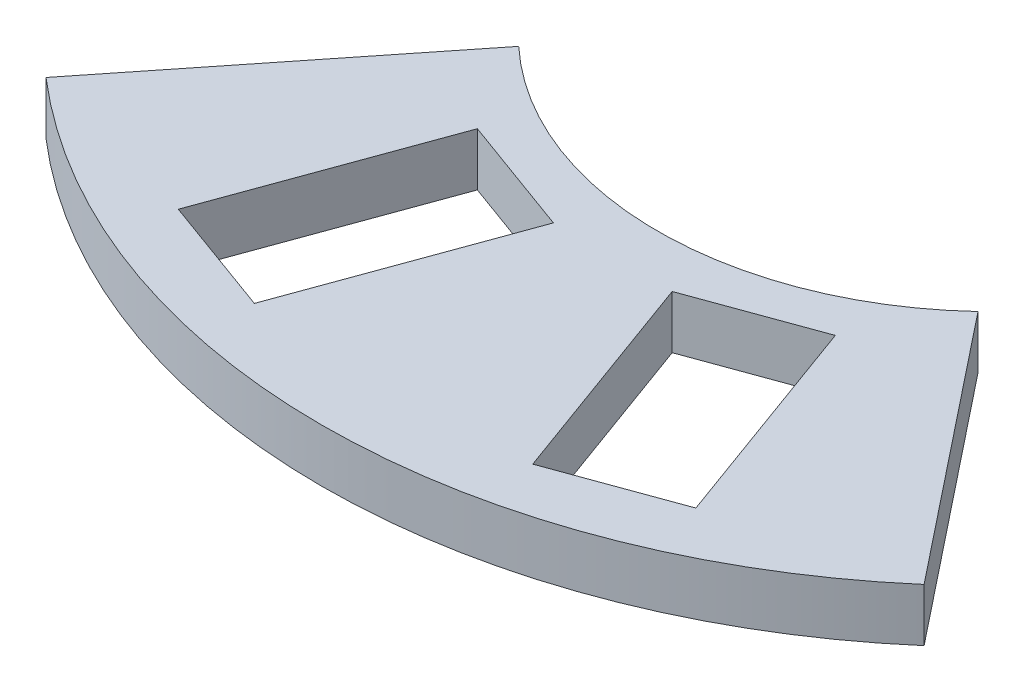
from build123d import *

# Parameters (mm, degrees)
EXTRUDE_1_DEPTH = 5


with BuildPart() as part:
    # 草图1 → 凸台-拉伸1 (new body)
    with BuildSketch(Plane(origin=(0, 0, 0), x_dir=(1, 0, 0), z_dir=(0, 1, 0))):
        with BuildLine():
            Line((-21.653867872, 23.131212261), (-41.397029955, -1.695585454))
            ThreePointArc((-41.397029955, -1.695585454), (0, -17.080137941), (41.397029955, -1.695585454))
            Line((41.397029955, -1.695585454), (21.653867872, 23.131212261))
            ThreePointArc((21.653867872, 23.131212261), (0, 14.589673731), (-21.653867872, 23.131212261))
        make_face()
        Polygon((-24.400377301, -6.217451313), (-13.124065852, -10.321693033), (-5.599622699, 10.351544624), (-16.875934148, 14.455786344), align=None, mode=Mode.SUBTRACT)
        Polygon((16.875934148, 14.455786344), (5.599622699, 10.351544624), (13.124065852, -10.321693033), (24.400377301, -6.217451313), align=None, mode=Mode.SUBTRACT)
    extrude(amount=EXTRUDE_1_DEPTH)


solid = part.part
